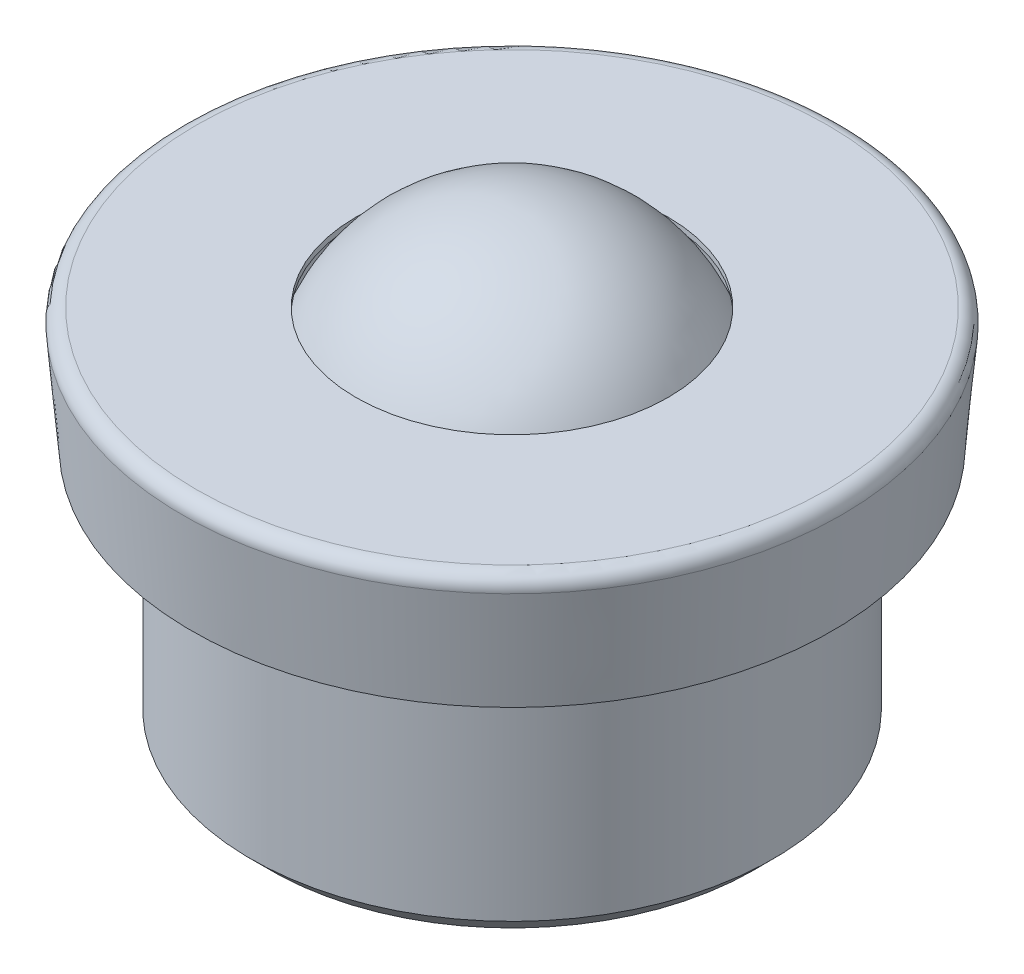
from build123d import *

# Parameters (mm, degrees)
SKETCH6_R          = 0.635
CUT_EXTRUDE1_DEPTH = 30.678184065
CHAMFER1_SIZE      = 0.889
FILLET1_R          = 0.635


with BuildPart() as part:
    # Sketch2 → Revolve1 (revolve)
    with BuildSketch(Plane.XY):
        with BuildLine():
            Line((0, -7.9375), (0, 7.9375))
            ThreePointArc((0, 7.9375), (7.9375, 0), (0, -7.9375))
        make_face()
    revolve(axis=Axis((0, -7.9375, 0), (0, 1, 0)))


with BuildPart() as body_2:
    # Sketch3 → Revolve2 (revolve)
    with BuildSketch(Plane.XY, mode=Mode.PRIVATE) as revolve2_sk:
        Polygon((14.804057641, 3.7585), (14.358565366, -1.3335), (14.347454306, -1.4605), (14.602424545, -1.4605), (15.08125, 4.0125), (7.118250532, 4.0125), (7.118250532, 3.7585), align=None)
    revolve(revolve2_sk.sketch.rotate(Axis((0, 0, 0), (0, -1, 0)), 180), axis=Axis((0, 0, 0), (0, -1, 0)))

    # Fillet1
    fillet1_edges = [body_2.edges().sort_by_distance(p)[0] for p in [
        (15.08125, 4.0125, 0),
    ]]
    fillet(fillet1_edges, radius=FILLET1_R)


with BuildPart() as body_3:
    # Sketch4 → Revolve3 (revolve)
    with BuildSketch(Plane.XY, mode=Mode.PRIVATE) as revolve3_sk:
        with BuildLine():
            Line((11.90625, -1.5875), (14.104565366, -1.5875))
            Line((14.104565366, -1.5875), (14.358565366, -1.3335))
            Line((14.358565366, -1.3335), (14.804057641, 3.7585))
            Line((14.804057641, 3.7585), (9.780167892, 3.7585))
            ThreePointArc((9.780167892, 3.7585), (8.635904411, -5.932888104), (0, -10.4775))
            Line((0, -10.4775), (0, -12.7))
            Line((0, -12.7), (11.90625, -12.7))
            Line((11.90625, -12.7), (11.90625, -1.5875))
        make_face()
    revolve(revolve3_sk.sketch.rotate(Axis((0, 0, 0), (0, -1, 0)), 180), axis=Axis((0, 0, 0), (0, -1, 0)))

    # Sketch6 → Cut-Extrude1 (cut, through all)
    with BuildSketch(Plane.XZ.offset(12.7)):
        Circle(SKETCH6_R)
    extrude(amount=-CUT_EXTRUDE1_DEPTH, mode=Mode.SUBTRACT)

    # Chamfer1
    chamfer1_edges = [body_3.edges().sort_by_distance(p)[0] for p in [
        (11.90625, -12.7, 0),
    ]]
    chamfer(chamfer1_edges, length=CHAMFER1_SIZE)


solid = Compound([part.part, body_2.part, body_3.part])
